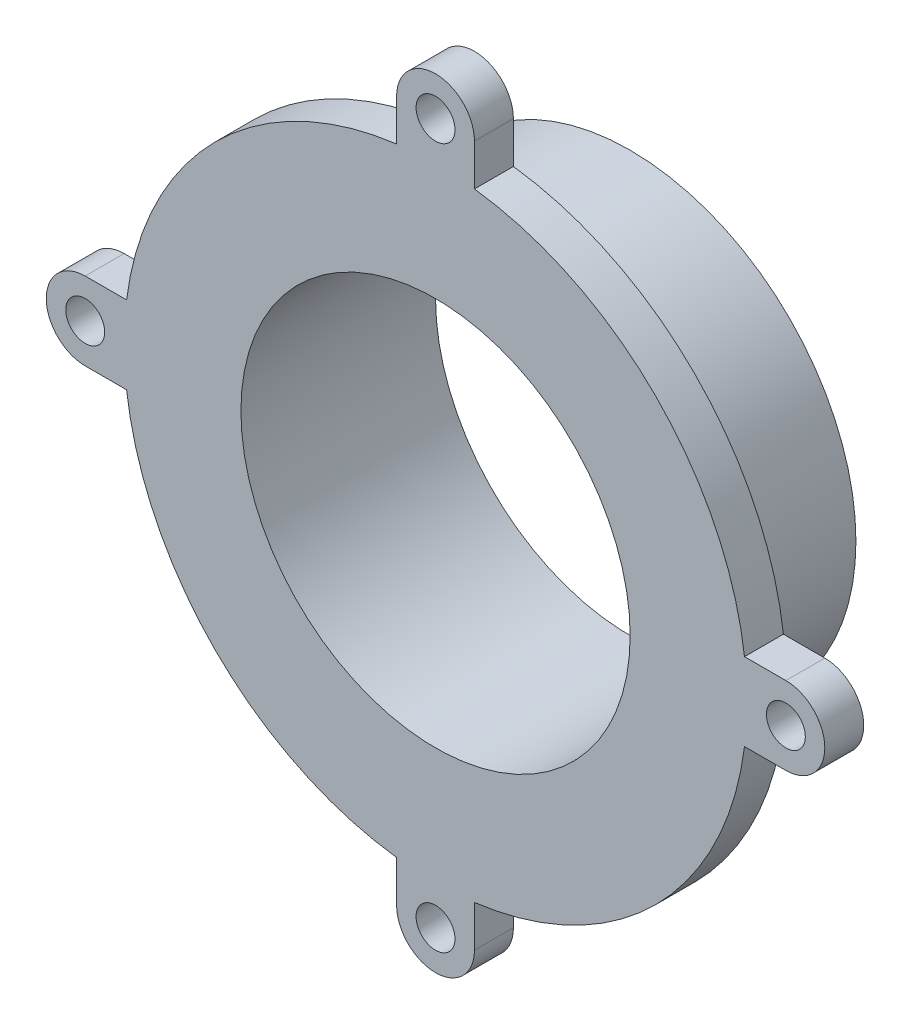
from build123d import *

# Parameters (mm, degrees)
SKETCH2_R           = 40
BOSS_EXTRUDE2_DEPTH = 5
SKETCH3_R           = 25
CUT_EXTRUDE2_DEPTH  = 8
BOSS_EXTRUDE3_START = 20
SKETCH4_R           = 29
SKETCH4_R_2         = 25
BOSS_EXTRUDE3_DEPTH = 20
BOSS_EXTRUDE4_START = -5
SKETCH5_R           = 2.5
BOSS_EXTRUDE4_DEPTH = 5
CIRPATTERN1_COUNT   = 4


with BuildPart() as part:
    # Sketch2 → Boss-Extrude2 (new body)
    with BuildSketch(Plane.XY):
        Circle(SKETCH2_R)
    extrude(amount=BOSS_EXTRUDE2_DEPTH)

    # Sketch3 → Cut-Extrude2 (cut)
    with BuildSketch(Plane(origin=(0, 0, 0), x_dir=(-1, 0, 0), z_dir=(0, 0, -1))):
        Circle(SKETCH3_R)
    extrude(amount=-CUT_EXTRUDE2_DEPTH, mode=Mode.SUBTRACT)

    # Sketch4 → Boss-Extrude3 (add)
    with BuildSketch(Plane(origin=(0, 0, 0), x_dir=(-1, 0, 0), z_dir=(0, 0, -1)).offset(BOSS_EXTRUDE3_START)):
        with Locations(Location((0, 0, 0), (0, 0, 180))):
            Circle(SKETCH4_R)
        Circle(SKETCH4_R_2, mode=Mode.SUBTRACT)
    extrude(amount=-BOSS_EXTRUDE3_DEPTH)

    # Sketch5 → Boss-Extrude4 (add)
    with BuildSketch(Plane.XY.offset(5).offset(BOSS_EXTRUDE4_START)):
        with BuildLine():
            Line((-5, 39.686269666), (-5, 45))
            ThreePointArc((-5, 45), (0, 50), (5, 45))
            Line((5, 45), (5, 39.686269666))
            ThreePointArc((5, 39.686269666), (0, 40), (-5, 39.686269666))
        make_face()
        with Locations((0, 45)):
            Circle(SKETCH5_R, mode=Mode.SUBTRACT)
    boss_extrude4 = extrude(amount=BOSS_EXTRUDE4_DEPTH)

    # CirPattern1: Boss-Extrude4 ×4 about axis
    cirpattern1_axis = Axis((0, 0, 0), (0, 0, 1))
    for i in range(1, CIRPATTERN1_COUNT):
        add(boss_extrude4.rotate(cirpattern1_axis, i * 360 / CIRPATTERN1_COUNT))


solid = part.part
